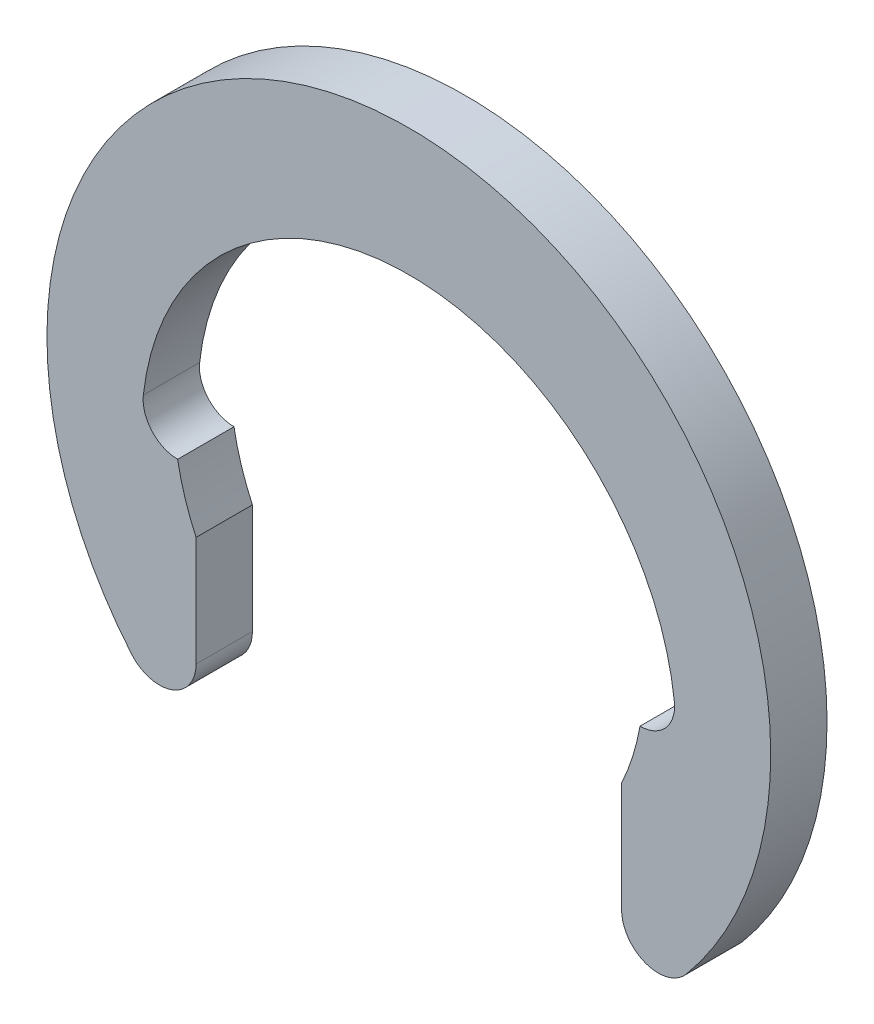
from build123d import *

# Parameters (mm, degrees)
BODY_DEPTH = 0.6


with BuildPart() as part:
    # BodySke → Body (new body)
    with BuildSketch(Plane.XY):
        with BuildLine():
            Line((2.265769468, -1.056545654), (2.265769468, -2.224261502))
            ThreePointArc((2.265769468, -2.224261502), (2.522551556, -2.590803434), (2.95475915, -2.474671505))
            ThreePointArc((2.95475915, -2.474671505), (0, 3.854166667), (-2.95475915, -2.474671505))
            ThreePointArc((-2.95475915, -2.474671505), (-2.522551556, -2.590803434), (-2.265769468, -2.224261502))
            Line((-2.265769468, -2.224261502), (-2.265769468, -1.056545654))
            ThreePointArc((-2.265769468, -1.056545654), (-2.384292377, -0.751764499), (-2.462019383, -0.434120444))
            ThreePointArc((-2.462019383, -0.434120444), (-2.736711011, -0.311110876), (-2.82786799, -0.024270764))
            ThreePointArc((-2.82786799, -0.024270764), (0, 2.5), (2.82786799, -0.024270764))
            ThreePointArc((2.82786799, -0.024270764), (2.736711011, -0.311110876), (2.462019383, -0.434120444))
            ThreePointArc((2.462019383, -0.434120444), (2.384292377, -0.751764499), (2.265769468, -1.056545654))
        make_face()
    extrude(amount=-BODY_DEPTH)


solid = part.part
